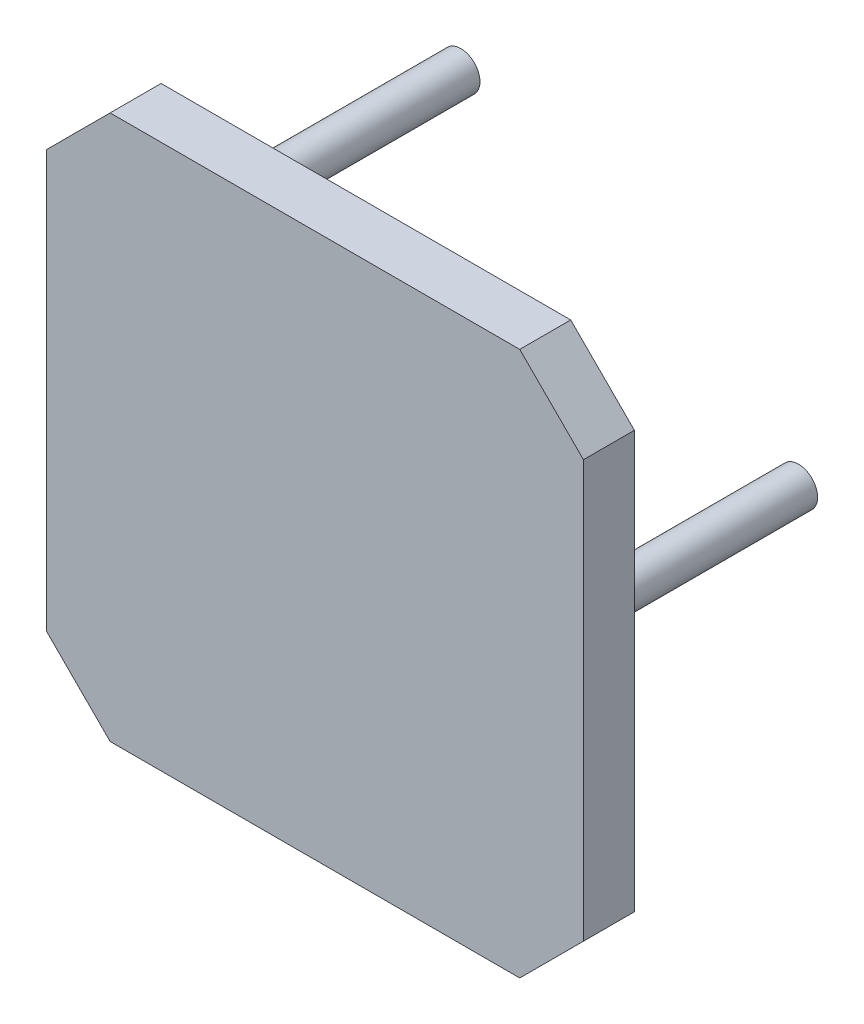
from build123d import *

# Parameters (mm, degrees)
ESQUISSE1_W        = 42.15149663
ESQUISSE1_H        = 42.731591692
BOSS_EXTRU_1_DEPTH = 4
CHANFREIN1_SIZE    = 5
ESQUISSE3_R        = 1.5
BOSS_EXTRU_3_DEPTH = 19


with BuildPart() as part:
    # Esquisse1 → Boss.-Extru.1 (new body)
    with BuildSketch(Plane.XY):
        with Locations((5.045077825, 0)):
            Rectangle(ESQUISSE1_W, ESQUISSE1_H)
    extrude(amount=BOSS_EXTRU_1_DEPTH)

    # Chanfrein1
    chanfrein1_edges = [part.edges().sort_by_distance(p)[0] for p in [
        (-16.03067049, -21.365795846, 2),
        (-16.03067049, 21.365795846, 2),
        (26.12082614, 21.365795846, 2),
        (26.12082614, -21.365795846, 2),
    ]]
    chamfer(chanfrein1_edges, length=CHANFREIN1_SIZE)

    # Esquisse3 → Boss.-Extru.3 (add)
    with BuildSketch(Plane(origin=(0, 0, 0), x_dir=(-1, 0, 0), z_dir=(0, 0, -1))):
        with Locations((-20, 0)):
            Circle(ESQUISSE3_R)
        with Locations((6.5, 15)):
            Circle(ESQUISSE3_R)
        with Locations(Location((6.5, -15, 0), (0, 0, 180))):
            Circle(ESQUISSE3_R)
    extrude(amount=BOSS_EXTRU_3_DEPTH)


solid = part.part
